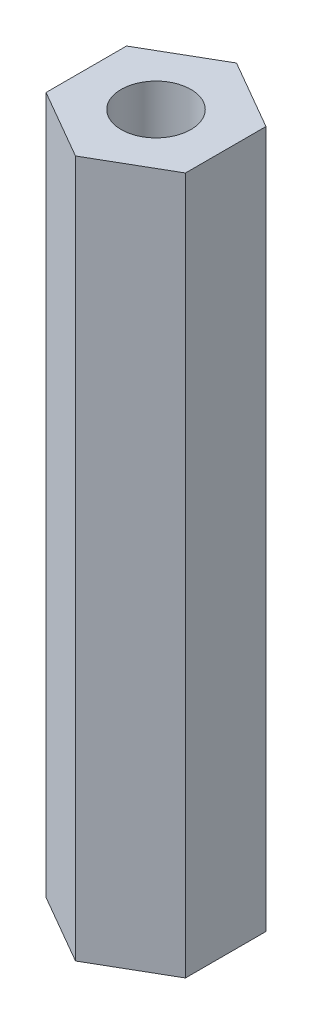
from build123d import *

# Parameters (mm, degrees)
SKETCH1_R           = 1
BOSS_EXTRUDE1_DEPTH = 20


with BuildPart() as part:
    # Sketch1 → Boss-Extrude1 (new body)
    with BuildSketch(Plane(origin=(0, 0, 0), x_dir=(1, 0, 0), z_dir=(0, 1, 0))):
        Polygon((2, -1.154700538), (2, 1.154700538), (0, 2.309401077), (-2, 1.154700538), (-2, -1.154700538), (0, -2.309401077), align=None)
        with Locations(Location((0, 0, 0), (0, 0, 270))):
            Circle(SKETCH1_R, mode=Mode.SUBTRACT)
    extrude(amount=BOSS_EXTRUDE1_DEPTH)


solid = part.part
